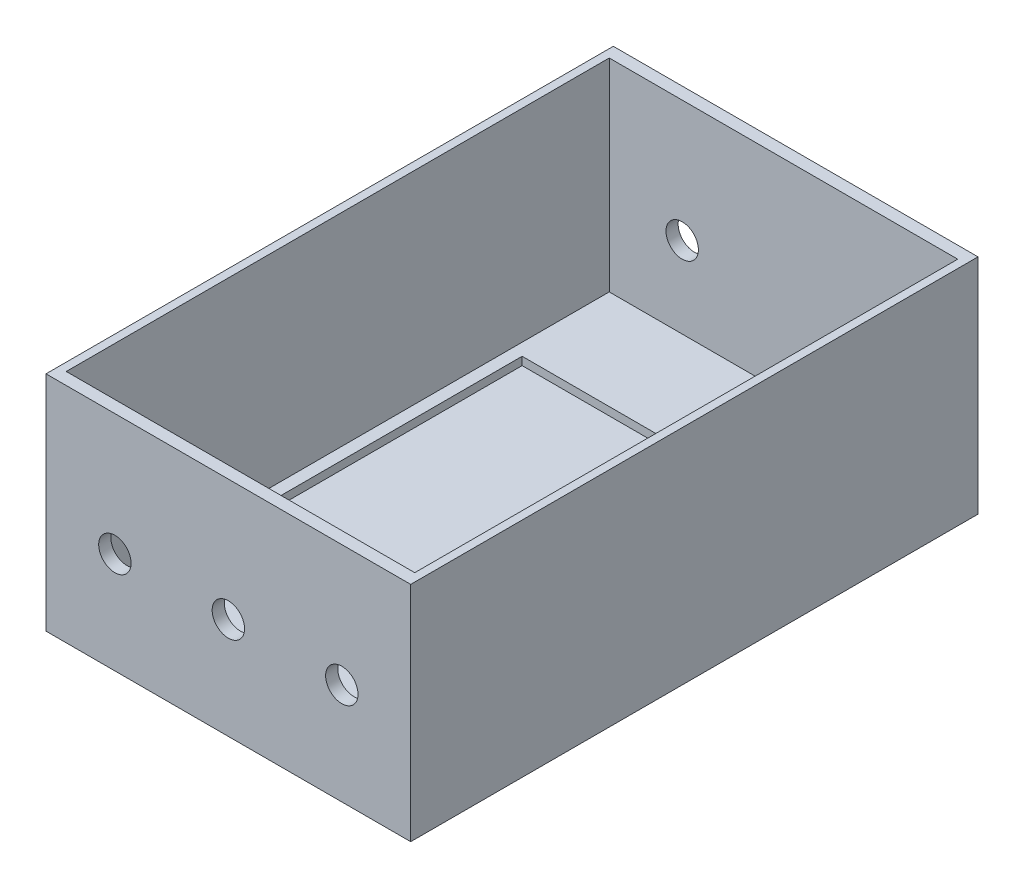
from build123d import *

# Parameters (mm, degrees)
SKETCH1_W           = 90
SKETCH1_H           = 140
BOSS_EXTRUDE1_DEPTH = 5
SKETCH2_W           = 80
SKETCH2_H           = 85
CUT_EXTRUDE1_DEPTH  = 2
SKETCH3_W           = 90
SKETCH3_H           = 3
BOSS_EXTRUDE2_DEPTH = 50
SKETCH4_W           = 2
SKETCH4_H           = 134
BOSS_EXTRUDE3_DEPTH = 50
SKETCH5_R           = 4
CUT_EXTRUDE2_DEPTH  = 3
SKETCH6_R           = 4
CUT_EXTRUDE3_DEPTH  = 3


with BuildPart() as part:
    # Sketch1 → Boss-Extrude1 (new body)
    with BuildSketch(Plane(origin=(0, 0, 0), x_dir=(1, 0, 0), z_dir=(0, 1, 0))):
        Rectangle(SKETCH1_W, SKETCH1_H)
    extrude(amount=BOSS_EXTRUDE1_DEPTH)

    # Sketch2 → Cut-Extrude1 (cut)
    with BuildSketch(Plane(origin=(0, 5, 0), x_dir=(1, 0, 0), z_dir=(0, 1, 0))):
        Rectangle(SKETCH2_W, SKETCH2_H)
    extrude(amount=-CUT_EXTRUDE1_DEPTH, mode=Mode.SUBTRACT)

    # Sketch3 → Boss-Extrude2 (add)
    with BuildSketch(Plane(origin=(0, 5, 0), x_dir=(1, 0, 0), z_dir=(0, 1, 0))):
        with Locations((0, -68.5)):
            Rectangle(SKETCH3_W, SKETCH3_H)
        with Locations((0, 68.5)):
            Rectangle(SKETCH3_W, SKETCH3_H)
    extrude(amount=BOSS_EXTRUDE2_DEPTH)

    # Sketch4 → Boss-Extrude3 (add)
    with BuildSketch(Plane(origin=(0, 5, 0), x_dir=(1, 0, 0), z_dir=(0, 1, 0))):
        with Locations((-44, 0)):
            Rectangle(SKETCH4_W, SKETCH4_H)
        with Locations((44, 0)):
            Rectangle(SKETCH4_W, SKETCH4_H)
    extrude(amount=BOSS_EXTRUDE3_DEPTH)

    # Sketch5 → Cut-Extrude2 (cut)
    with BuildSketch(Plane.XY.offset(70)):
        with Locations((0, 25)):
            Circle(SKETCH5_R)
        with Locations((28, 25)):
            Circle(SKETCH5_R)
        with Locations((-28, 25)):
            Circle(SKETCH5_R)
    extrude(amount=-CUT_EXTRUDE2_DEPTH, mode=Mode.SUBTRACT)

    # Sketch6 → Cut-Extrude3 (cut)
    with BuildSketch(Plane(origin=(0, 0, -70), x_dir=(-1, 0, 0), z_dir=(0, 0, -1))):
        with Locations((-25, 25)):
            Circle(SKETCH6_R)
        with Locations((25, 25)):
            Circle(SKETCH6_R)
    extrude(amount=-CUT_EXTRUDE3_DEPTH, mode=Mode.SUBTRACT)


solid = part.part
